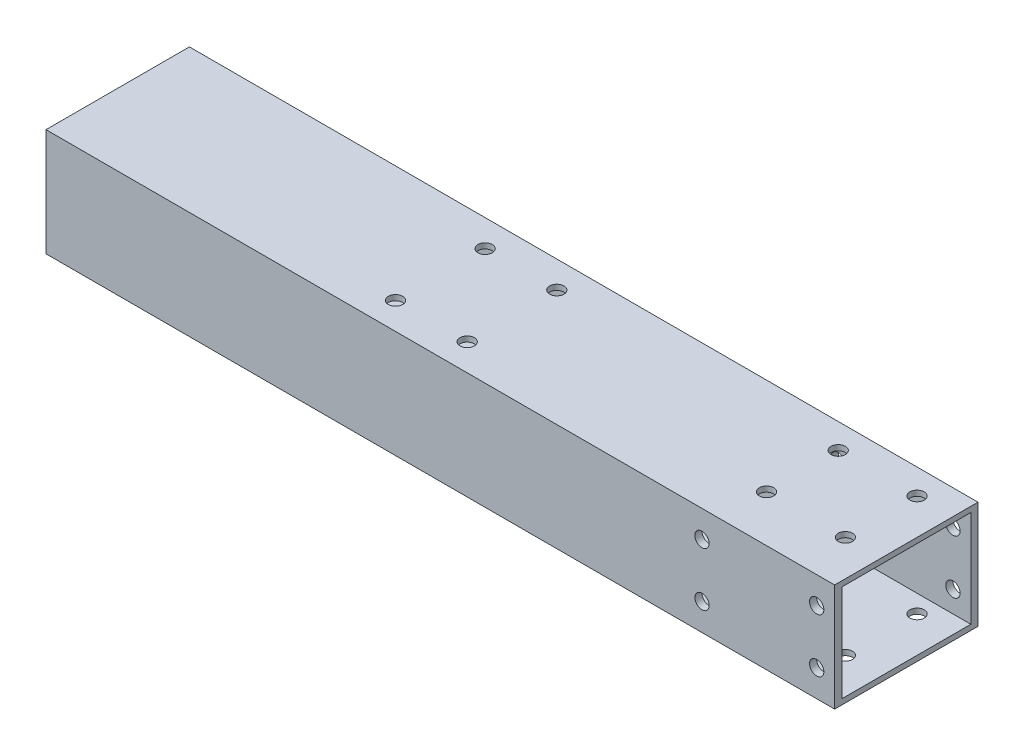
from build123d import *

# Parameters (mm, degrees)
SKETCH_1_W          = 40
SKETCH_1_H          = 30
SKETCH_1_W_2        = 36
SKETCH_1_H_2        = 27
EXTRUDE_1_DEPTH     = 220
SKETCH_2_R          = 2
CUT_EXTRUDE_1_DEPTH = 223.934968096
SKETCH_3_R          = 2
CUT_EXTRUDE_2_DEPTH = 223.934968096
SKETCH_4_R          = 2
CUT_EXTRUDE_3_DEPTH = 225.10934831


with BuildPart() as part:
    # 草图1 → 凸台-拉伸1 (new body)
    with BuildSketch(Plane(origin=(0, 0, 0), x_dir=(0, 0, -1), z_dir=(1, 0, 0))):
        Rectangle(SKETCH_1_W, SKETCH_1_H)
        Rectangle(SKETCH_1_W_2, SKETCH_1_H_2, mode=Mode.SUBTRACT)
    extrude(amount=EXTRUDE_1_DEPTH)

    # 草图2 → 切除-拉伸1 (cut, through all)
    with BuildSketch(Plane(origin=(0, 15, 0), x_dir=(1, 0, 0), z_dir=(0, 1, 0))):
        with Locations(Location((210, -7, 0), (0, 0, 270))):
            Circle(SKETCH_2_R)
        with Locations(Location((210, 13, 0), (0, 0, 270))):
            Circle(SKETCH_2_R)
        with Locations(Location((188, 13, 0), (0, 0, 270))):
            Circle(SKETCH_2_R)
        with Locations(Location((188, -7, 0), (0, 0, 270))):
            Circle(SKETCH_2_R)
    extrude(amount=-CUT_EXTRUDE_1_DEPTH, mode=Mode.SUBTRACT)

    # 草图3 → 切除-拉伸2 (cut, through all)
    with BuildSketch(Plane(origin=(0, 15, 0), x_dir=(1, 0, 0), z_dir=(0, 1, 0))):
        with Locations(Location((90, 12.5, 0), (0, 0, 270))):
            Circle(SKETCH_3_R)
        with Locations(Location((110, 12.5, 0), (0, 0, 270))):
            Circle(SKETCH_3_R)
        with Locations(Location((110, -12.5, 0), (0, 0, 270))):
            Circle(SKETCH_3_R)
        with Locations(Location((90, -12.5, 0), (0, 0, 270))):
            Circle(SKETCH_3_R)
    extrude(amount=-CUT_EXTRUDE_2_DEPTH, mode=Mode.SUBTRACT)

    # 草图4 → 切除-拉伸3 (cut, through all)
    with BuildSketch(Plane.XY.offset(20)):
        with Locations((183, 7.5)):
            Circle(SKETCH_4_R)
        with Locations((215, 7.5)):
            Circle(SKETCH_4_R)
        with Locations((215, -7.5)):
            Circle(SKETCH_4_R)
        with Locations((183, -7.5)):
            Circle(SKETCH_4_R)
    extrude(amount=-CUT_EXTRUDE_3_DEPTH, mode=Mode.SUBTRACT)


solid = part.part
